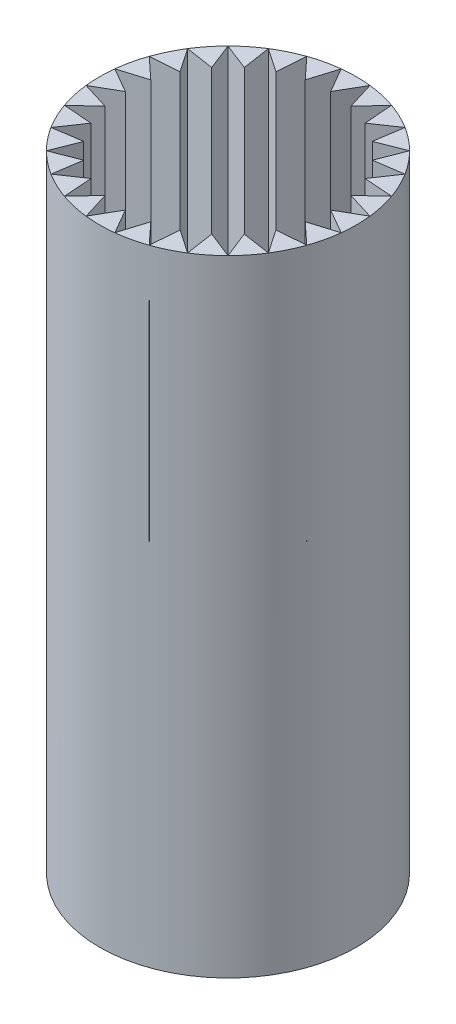
from build123d import *

# Parameters (mm, degrees)
SKETCH1_R           = 6.35
BOSS_EXTRUDE1_DEPTH = 18.000000068
SKETCH2_R           = 6.35
BOSS_EXTRUDE2_DEPTH = 0.254
SKETCH4_R           = 6.35
BOSS_EXTRUDE3_DEPTH = 12.7
CUT_EXTRUDE4_DEPTH  = 12.7


with BuildPart() as part:
    # Sketch1 → Boss-Extrude1 (new body)
    with BuildSketch(Plane(origin=(0, 0, 0), x_dir=(1, 0, 0), z_dir=(0, 1, 0))):
        with Locations(Location((0, 0, 0), (0, 0, 270))):
            Circle(SKETCH1_R)
        with BuildLine():
            Line((-1.855488288, -1.67829283), (1.855488288, -1.67829283))
            ThreePointArc((1.855488288, -1.67829283), (0, 2.5019), (-1.855488288, -1.67829283))
        make_face(mode=Mode.SUBTRACT)
    extrude(amount=BOSS_EXTRUDE1_DEPTH)

    # Sketch2 → Boss-Extrude2 (add)
    with BuildSketch(Plane(origin=(0, 18.000000068, 0), x_dir=(1, 0, 0), z_dir=(0, 1, 0))):
        with Locations(Location((0, 0, 0), (0, 0, 270))):
            Circle(SKETCH2_R)
    extrude(amount=BOSS_EXTRUDE2_DEPTH)

    # Sketch4 → Boss-Extrude3 (add)
    with BuildSketch(Plane(origin=(0, 18.254000068, 0), x_dir=(1, 0, 0), z_dir=(0, 1, 0))):
        with Locations(Location((0, 0, 0), (0, 0, 270))):
            Circle(SKETCH4_R)
    extrude(amount=BOSS_EXTRUDE3_DEPTH)

    # Sketch7 → Cut-Extrude4 (cut)
    with BuildSketch(Plane(origin=(0, 30.954000068, 0), x_dir=(1, 0, 0), z_dir=(0, 1, 0))):
        Polygon((0, 5.078212578), (0.7112, 6.310047112), (1.130008606, 4.950891186), (2.097486308, 5.993584169), (2.203353861, 4.575311437), (3.378595894, 5.376577888), (3.166213754, 3.970306468), (4.490288574, 4.489967541), (3.970306468, 3.166213754), (5.376819435, 3.378211473), (4.575311437, 2.203353861), (5.993734118, 2.097057776), (4.950891186, 1.130008606), (6.310097945, 0.710748846), (5.078212578, 0), (6.310047112, -0.7112), (4.950891186, -1.130008606), (5.993584169, -2.097486308), (4.575311437, -2.203353861), (5.376577888, -3.378595894), (3.970306468, -3.166213754), (4.489967541, -4.490288574), (3.166213754, -3.970306468), (3.378211473, -5.376819435), (2.203353861, -4.575311437), (2.097057776, -5.993734118), (1.130008606, -4.950891186), (0.710748846, -6.310097945), (0, -5.078212578), (-0.7112, -6.310047112), (-1.130008606, -4.950891186), (-2.097486308, -5.993584169), (-2.203353861, -4.575311437), (-3.378595894, -5.376577888), (-3.166213754, -3.970306468), (-4.490288574, -4.489967541), (-3.970306468, -3.166213754), (-5.376819435, -3.378211473), (-4.575311437, -2.203353861), (-5.993734118, -2.097057776), (-4.950891186, -1.130008606), (-6.310097945, -0.710748846), (-5.078212578, 0), (-6.310047112, 0.7112), (-4.950891186, 1.130008606), (-5.993584169, 2.097486308), (-4.575311437, 2.203353861), (-5.376577888, 3.378595894), (-3.970306468, 3.166213754), (-4.489967541, 4.490288574), (-3.166213754, 3.970306468), (-3.378211473, 5.376819435), (-2.203353861, 4.575311437), (-2.097057776, 5.993734118), (-1.130008606, 4.950891186), (-0.7112, 6.310047112), align=None)
    extrude(amount=-CUT_EXTRUDE4_DEPTH, mode=Mode.SUBTRACT)


solid = part.part
